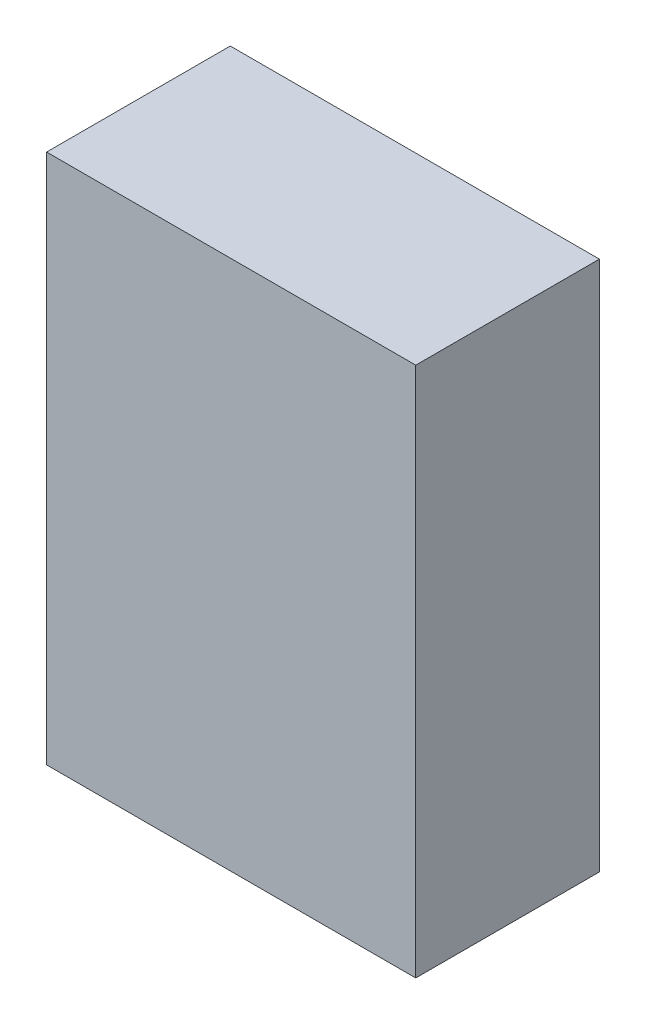
from build123d import *

# Parameters (mm, degrees)
SKETCH1_W               = 2.01
SKETCH1_H               = 2.89
COMPONENT_OUTLINE_DEPTH = 1


with BuildPart() as part:
    # Sketch1 → Component_Outline (new body)
    with BuildSketch(Plane.XY):
        with Locations((1.005, 1.445)):
            Rectangle(SKETCH1_W, SKETCH1_H)
    extrude(amount=COMPONENT_OUTLINE_DEPTH)


solid = part.part
